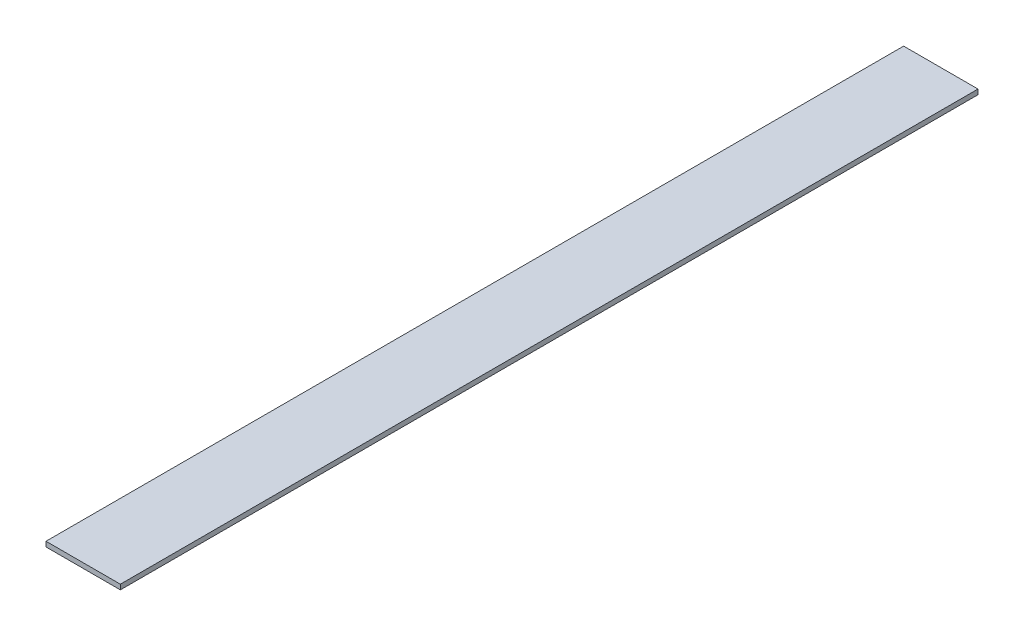
from build123d import *

# Parameters (mm, degrees)
BOSS_EXTRUDE1_DEPTH      = 200
BOSS_EXTRUDE1_DEPTH_BACK = 146
SKETCH1_W                = 30
SKETCH1_H                = 2


with BuildPart() as part:
    # Sketch1 → Boss-Extrude1 (new, two sides: drawn at the far end of the back side and taken through both)
    with BuildSketch(Plane.XY.offset(-BOSS_EXTRUDE1_DEPTH_BACK)):
        Rectangle(SKETCH1_W, SKETCH1_H)
    extrude(amount=BOSS_EXTRUDE1_DEPTH + BOSS_EXTRUDE1_DEPTH_BACK)


solid = part.part
